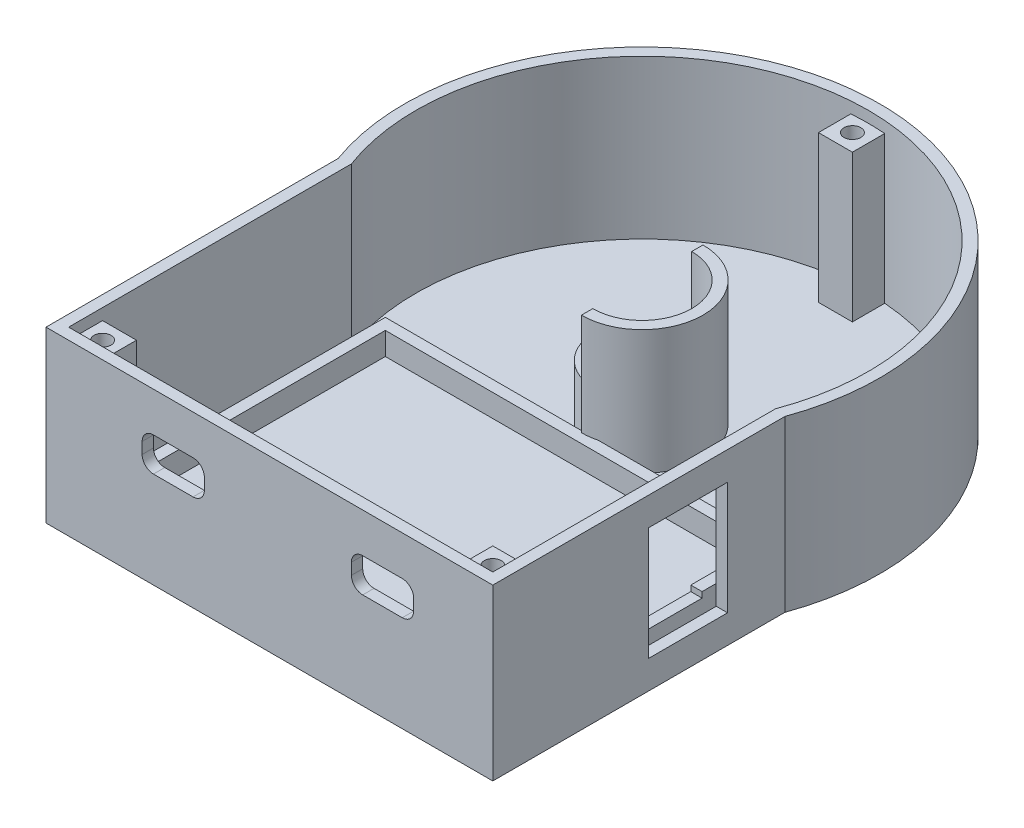
from build123d import *

# Parameters (mm, degrees)
BOSS_EXTRUDE1_DEPTH = 2
BOSS_EXTRUDE2_DEPTH = 30
BOSS_EXTRUDE3_DEPTH = 22
SKETCH4_R           = 8.495
BOSS_EXTRUDE4_DEPTH = 9.7
SKETCH5_W           = 6
SKETCH5_H           = 6
SKETCH5_R           = 1.5
BOSS_EXTRUDE5_DEPTH = 26
SKETCH6_W           = 75
SKETCH6_H           = 20
CUT_EXTRUDE1_DEPTH  = 6
SKETCH8_W           = 70
SKETCH8_H           = 50
SKETCH8_W_2         = 66
SKETCH8_H_2         = 46
BOSS_EXTRUDE6_DEPTH = 4
SKETCH9_W           = 11
SKETCH9_H           = 6
CUT_EXTRUDE3_DEPTH  = 4
FILLET1_R           = 2
SKETCH10_W          = 14
SKETCH10_H          = 20
CUT_EXTRUDE4_DEPTH  = 10


with BuildPart() as part:
    # Sketch1 → Boss-Extrude1 (new body)
    with BuildSketch(Plane(origin=(0, 0, 0), x_dir=(1, 0, 0), z_dir=(0, 1, 0))):
        with BuildLine():
            Line((-37.5, 25), (-37.5, -25))
            Line((-37.5, -25), (37.5, -25))
            Line((37.5, -25), (37.5, 25))
            ThreePointArc((37.5, 25), (0, 78.919410907), (-37.5, 25))
        make_face()
    extrude(amount=BOSS_EXTRUDE1_DEPTH)

    # Sketch2 → Boss-Extrude2 (add)
    with BuildSketch(Plane.XZ):
        with BuildLine():
            Line((-39.5, -24.645308483), (-39.5, 27))
            Line((-39.5, 27), (39.5, 27))
            Line((39.5, 27), (39.5, -24.645308483))
            ThreePointArc((39.5, -24.645308483), (0, -80.919410907), (-39.5, -24.645308483))
        make_face()
        with BuildLine():
            Line((-37.5, -25), (-37.5, 25))
            Line((-37.5, 25), (37.5, 25))
            Line((37.5, 25), (37.5, -25))
            ThreePointArc((37.5, -25), (0, -78.919410907), (-37.5, -25))
        make_face(mode=Mode.SUBTRACT)
    extrude(amount=-BOSS_EXTRUDE2_DEPTH)

    # Sketch3 → Boss-Extrude3 (add)
    with BuildSketch(Plane(origin=(0, 2, 0), x_dir=(1, 0, 0), z_dir=(0, 1, 0))):
        with BuildLine():
            Line((0, 49.669410907), (0, 47.669410907))
            ThreePointArc((0, 47.669410907), (8.75, 38.919410907), (0, 30.169410907))
            Line((0, 30.169410907), (0, 28.169410907))
            ThreePointArc((0, 28.169410907), (10.75, 38.919410907), (0, 49.669410907))
        make_face()
    extrude(amount=BOSS_EXTRUDE3_DEPTH)

    # Sketch4 → Boss-Extrude4 (add)
    with BuildSketch(Plane(origin=(0, 2, 0), x_dir=(1, 0, 0), z_dir=(0, 1, 0))):
        with Locations(Location((0, 38.919410907, 0), (0, 0, 270))):
            Circle(SKETCH4_R)
    extrude(amount=BOSS_EXTRUDE4_DEPTH)

    # Sketch5 → Boss-Extrude5 (add)
    # profile 1 of 3: a face of its own
    with BuildSketch(Plane(origin=(0, 2, 0), x_dir=(1, 0, 0), z_dir=(0, 1, 0))):
        with Locations((-34.5, -22)):
            Rectangle(SKETCH5_W, SKETCH5_H)
        with Locations(Location((-34.5, -22, 0), (0, 0, 90))):
            Circle(SKETCH5_R, mode=Mode.SUBTRACT)
    # profile 2 of 3: a face of its own
    with BuildSketch(Plane(origin=(0, 2, 0), x_dir=(1, 0, 0), z_dir=(0, 1, 0))):
        with Locations((34.5, -22)):
            Rectangle(SKETCH5_W, SKETCH5_H)
        with Locations(Location((34.5, -22, 0), (0, 0, 90))):
            Circle(SKETCH5_R, mode=Mode.SUBTRACT)
    # profile 3 of 3: a face of its own
    with BuildSketch(Plane(origin=(0, 2, 0), x_dir=(1, 0, 0), z_dir=(0, 1, 0))):
        with Locations((0, 76.087024619)):
            Rectangle(SKETCH5_W, SKETCH5_H)
        with Locations(Location((0, 76.087024619, 0), (0, 0, 90))):
            Circle(SKETCH5_R, mode=Mode.SUBTRACT)
    extrude(amount=BOSS_EXTRUDE5_DEPTH)

    # Sketch6 → Cut-Extrude1 (cut)
    with BuildSketch(Plane(origin=(0, 0, 19), x_dir=(-1, 0, 0), z_dir=(0, 0, -1))):
        with Locations((0, 12)):
            Rectangle(SKETCH6_W, SKETCH6_H)
    extrude(amount=-CUT_EXTRUDE1_DEPTH, mode=Mode.SUBTRACT)

    # Sketch8 → Boss-Extrude6 (add)
    with BuildSketch(Plane(origin=(0, 2, 0), x_dir=(1, 0, 0), z_dir=(0, 1, 0))):
        with Locations((0, 3.5)):
            Rectangle(SKETCH8_W, SKETCH8_H)
        with Locations((0, 3.5)):
            Rectangle(SKETCH8_W_2, SKETCH8_H_2, mode=Mode.SUBTRACT)
    extrude(amount=BOSS_EXTRUDE6_DEPTH)

    # Sketch9 → Cut-Extrude3 (cut)
    with BuildSketch(Plane.XY.offset(27)):
        with Locations((-17, 20)):
            Rectangle(SKETCH9_W, SKETCH9_H)
        with Locations((20, 20)):
            Rectangle(SKETCH9_W, SKETCH9_H)
    extrude(amount=-CUT_EXTRUDE3_DEPTH, mode=Mode.SUBTRACT)

    # Fillet1
    fillet1_edges = [part.edges().sort_by_distance(p)[0] for p in [
        (-22.5, 17, 26),
        (-22.5, 23, 26),
        (-11.5, 23, 26),
        (-11.5, 17, 26),
        (14.5, 17, 26),
        (14.5, 23, 26),
        (25.5, 23, 26),
        (25.5, 17, 26),
    ]]
    fillet(fillet1_edges, radius=FILLET1_R)

    # Sketch10 → Cut-Extrude4 (cut)
    with BuildSketch(Plane(origin=(39.5, 0, 0), x_dir=(0, 0, -1), z_dir=(1, 0, 0))):
        with Locations((7.50936627, 15)):
            Rectangle(SKETCH10_W, SKETCH10_H)
    extrude(amount=-CUT_EXTRUDE4_DEPTH, mode=Mode.SUBTRACT)


solid = part.part
